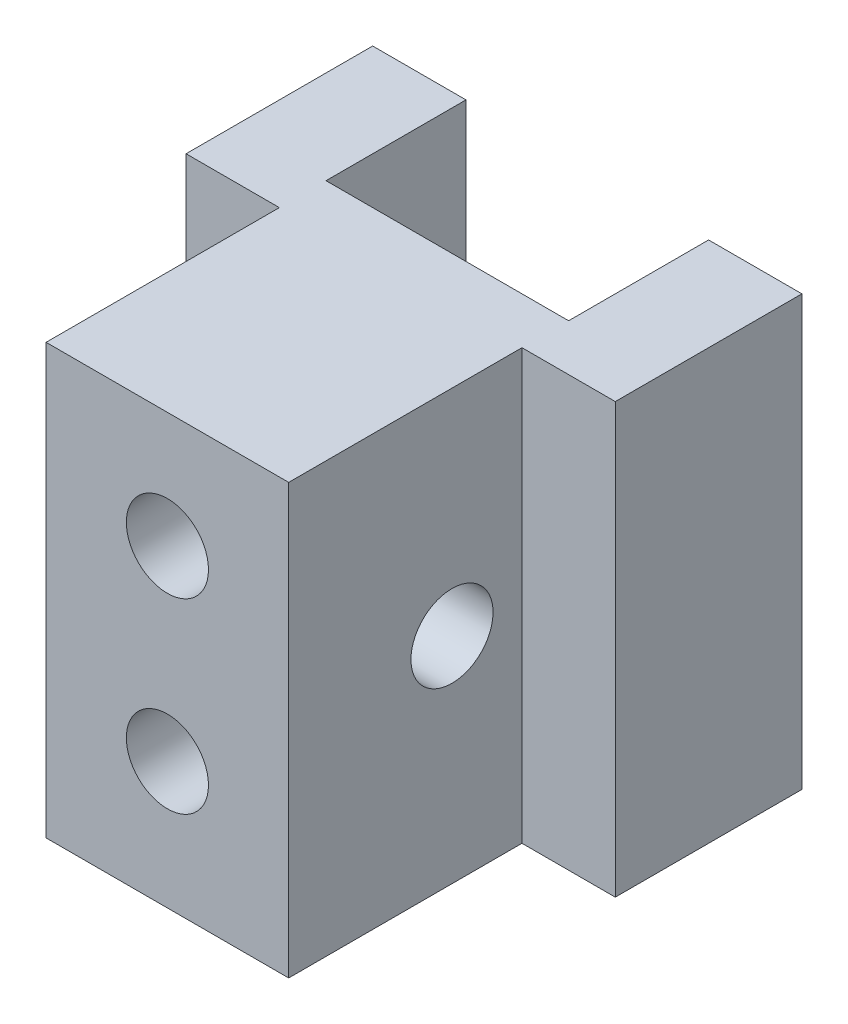
from build123d import *

# Parameters (mm, degrees)
SKETCH2_W           = 13
SKETCH2_H           = 23
SKETCH2_R           = 2.2
BOSS_EXTRUDE1_DEPTH = 10
SKETCH5_W           = 5
SKETCH5_H           = 23
BOSS_EXTRUDE2_DEPTH = 2.5
SKETCH6_W           = 5
SKETCH6_H           = 23
BOSS_EXTRUDE3_DEPTH = 7.5
CUT_EXTRUDE2_DEPTH  = 153.496625691
SKETCH8_W           = 13
SKETCH8_H           = 23
SKETCH8_R           = 2.2
BOSS_EXTRUDE4_DEPTH = 5


with BuildPart() as part:
    # Sketch2 → Boss-Extrude1 (new body)
    with BuildSketch(Plane.XY):
        with Locations((-27, -139.600035894)):
            Rectangle(SKETCH2_W, SKETCH2_H)
        with Locations((-27, -144.300035894)):
            Circle(SKETCH2_R, mode=Mode.SUBTRACT)
        with Locations((-27, -134.300035894)):
            Circle(SKETCH2_R, mode=Mode.SUBTRACT)
    extrude(amount=BOSS_EXTRUDE1_DEPTH)

    # Sketch5 → Boss-Extrude2 (add)
    with BuildSketch(Plane(origin=(0, 0, 0), x_dir=(-1, 0, 0), z_dir=(0, 0, -1))):
        with Locations((18, -139.600035894)):
            Rectangle(SKETCH5_W, SKETCH5_H)
        with Locations((36, -139.600035894)):
            Rectangle(SKETCH5_W, SKETCH5_H)
    extrude(amount=-BOSS_EXTRUDE2_DEPTH)

    # Sketch6 → Boss-Extrude3 (add)
    with BuildSketch(Plane(origin=(0, 0, 0), x_dir=(-1, 0, 0), z_dir=(0, 0, -1))):
        with Locations((18, -139.600035894)):
            Rectangle(SKETCH6_W, SKETCH6_H)
        with Locations((36, -139.600035894)):
            Rectangle(SKETCH6_W, SKETCH6_H)
    extrude(amount=BOSS_EXTRUDE3_DEPTH)

    # Sketch7 → Cut-Extrude2 (cut, through all)
    with BuildSketch(Plane(origin=(-20.5, 0, 0), x_dir=(0, 0, -1), z_dir=(1, 0, 0))):
        with BuildLine():
            ThreePointArc((-6.25, -137.400035894), (-8.45, -139.600035894), (-6.25, -141.800035894))
            Line((-6.25, -141.800035894), (-6.25, -137.400035894))
        make_face()
        with BuildLine():
            Line((-6.25, -137.400035894), (-6.25, -141.800035894))
            ThreePointArc((-6.25, -141.800035894), (-4.694365081, -141.155670812), (-4.05, -139.600035894))
            ThreePointArc((-4.05, -139.600035894), (-4.694365081, -138.044400975), (-6.25, -137.400035894))
        make_face()
    extrude(amount=-CUT_EXTRUDE2_DEPTH, mode=Mode.SUBTRACT)

    # Sketch8 → Boss-Extrude4 (add)
    with BuildSketch(Plane.XY.offset(10)):
        with Locations((-27, -139.600035894)):
            Rectangle(SKETCH8_W, SKETCH8_H)
        with Locations((-27, -134.300035894)):
            Circle(SKETCH8_R, mode=Mode.SUBTRACT)
        with Locations((-27, -144.300035894)):
            Circle(SKETCH8_R, mode=Mode.SUBTRACT)
    extrude(amount=BOSS_EXTRUDE4_DEPTH)


solid = part.part
